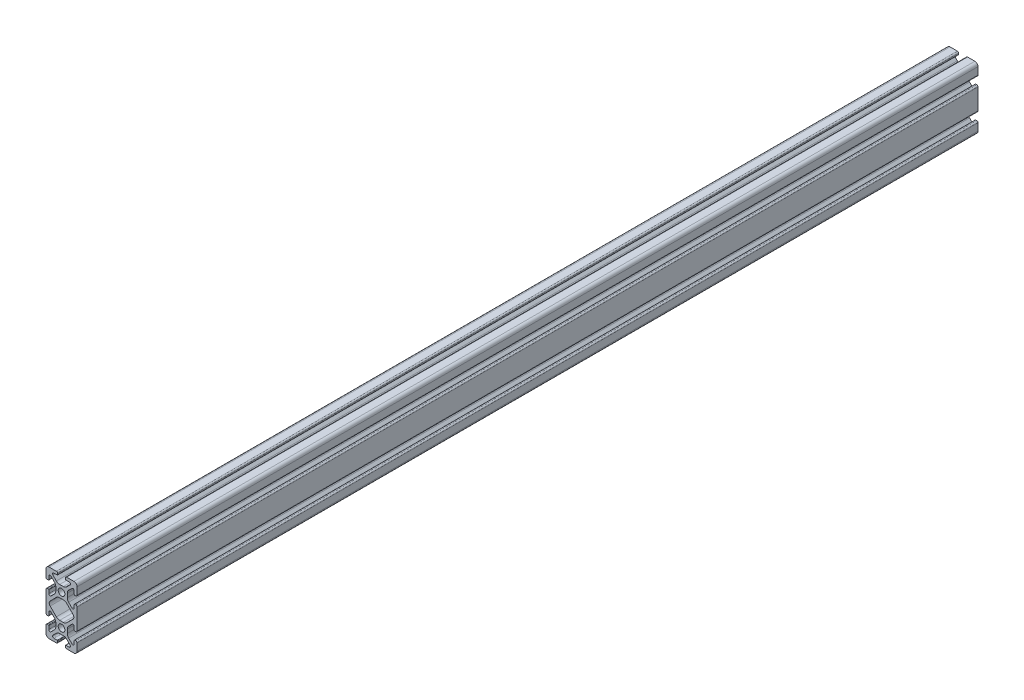
from build123d import *

# Parameters (mm, degrees)
SKETCH3_R           = 2.15
BOSS_EXTRUDE1_DEPTH = 304.8
CIRPATTERN1_COUNT   = 2
SKETCH4_R           = 2.15
CUT_EXTRUDE1_DEPTH  = 29.07


with BuildPart() as part:
    # Sketch3 → Boss-Extrude1 (new, symmetric)
    with BuildSketch(Plane.XY):
        with BuildLine():
            Line((-8.5, 7.5), (-9.2, 7.5))
            ThreePointArc((-9.2, 7.5), (-9.765685425, 7.265685425), (-10, 6.7))
            Line((-10, 6.7), (-10, 0))
            Line((-10, 0), (-7.916458339, 0))
            ThreePointArc((-7.916458339, 0), (-7.764217404, 0.765366865), (-7.330671901, 1.414213562))
            Line((-7.330671901, 1.414213562), (-3.32356512, 5.421320344))
            ThreePointArc((-3.32356512, 5.421320344), (-2.350295073, 6.071638598), (-1.202244776, 6.3))
            Line((-1.202244776, 6.3), (1.202244776, 6.3))
            ThreePointArc((1.202244776, 6.3), (2.350295073, 6.071638598), (3.32356512, 5.421320344))
            Line((3.32356512, 5.421320344), (7.330671901, 1.414213562))
            ThreePointArc((7.330671901, 1.414213562), (7.764217404, 0.765366865), (7.916458339, 0))
            Line((7.916458339, 0), (10, 0))
            Line((10, 0), (10, 6.7))
            ThreePointArc((10, 6.7), (9.765685425, 7.265685425), (9.2, 7.5))
            Line((9.2, 7.5), (8.5, 7.5))
            ThreePointArc((8.5, 7.5), (8.287867966, 7.412132034), (8.2, 7.2))
            Line((8.2, 7.2), (8.2, 5.094911614))
            ThreePointArc((8.2, 5.094911614), (7.678422063, 4.314315067), (6.757645654, 4.497468882))
            Line((6.757645654, 4.497468882), (4.578679656, 6.67643488))
            ThreePointArc((4.578679656, 6.67643488), (3.928361402, 7.649704927), (3.7, 8.797755224))
            Line((3.7, 8.797755224), (3.7, 11.202244776))
            ThreePointArc((3.7, 11.202244776), (3.928361402, 12.350295073), (4.578679656, 13.32356512))
            Line((4.578679656, 13.32356512), (6.757645654, 15.502531118))
            ThreePointArc((6.757645654, 15.502531118), (7.678422063, 15.685684933), (8.2, 14.905088386))
            Line((8.2, 14.905088386), (8.2, 12.8))
            ThreePointArc((8.2, 12.8), (8.287867966, 12.587867966), (8.5, 12.5))
            Line((8.5, 12.5), (9.2, 12.5))
            ThreePointArc((9.2, 12.5), (9.765685425, 12.734314575), (10, 13.3))
            Line((10, 13.3), (10, 18))
            ThreePointArc((10, 18), (9.414213562, 19.414213562), (8, 20))
            Line((8, 20), (3.3, 20))
            ThreePointArc((3.3, 20), (2.734314575, 19.765685425), (2.5, 19.2))
            Line((2.5, 19.2), (2.5, 18.5))
            ThreePointArc((2.5, 18.5), (2.587867966, 18.287867966), (2.8, 18.2))
            Line((2.8, 18.2), (4.905088386, 18.2))
            ThreePointArc((4.905088386, 18.2), (5.685684933, 17.678422063), (5.502531118, 16.757645654))
            Line((5.502531118, 16.757645654), (3.32356512, 14.578679656))
            ThreePointArc((3.32356512, 14.578679656), (2.350295073, 13.928361402), (1.202244776, 13.7))
            Line((1.202244776, 13.7), (-1.202244776, 13.7))
            ThreePointArc((-1.202244776, 13.7), (-2.350295073, 13.928361402), (-3.32356512, 14.578679656))
            Line((-3.32356512, 14.578679656), (-5.502531118, 16.757645654))
            ThreePointArc((-5.502531118, 16.757645654), (-5.685684933, 17.678422063), (-4.905088386, 18.2))
            Line((-4.905088386, 18.2), (-2.8, 18.2))
            ThreePointArc((-2.8, 18.2), (-2.587867966, 18.287867966), (-2.5, 18.5))
            Line((-2.5, 18.5), (-2.5, 19.2))
            ThreePointArc((-2.5, 19.2), (-2.734314575, 19.765685425), (-3.3, 20))
            Line((-3.3, 20), (-8, 20))
            ThreePointArc((-8, 20), (-9.414213562, 19.414213562), (-10, 18))
            Line((-10, 18), (-10, 13.3))
            ThreePointArc((-10, 13.3), (-9.765685425, 12.734314575), (-9.2, 12.5))
            Line((-9.2, 12.5), (-8.5, 12.5))
            ThreePointArc((-8.5, 12.5), (-8.287867966, 12.587867966), (-8.2, 12.8))
            Line((-8.2, 12.8), (-8.2, 14.905088386))
            ThreePointArc((-8.2, 14.905088386), (-7.678422063, 15.685684933), (-6.757645654, 15.502531118))
            Line((-6.757645654, 15.502531118), (-4.578679656, 13.32356512))
            ThreePointArc((-4.578679656, 13.32356512), (-3.928361402, 12.350295073), (-3.7, 11.202244776))
            Line((-3.7, 11.202244776), (-3.7, 8.797755224))
            ThreePointArc((-3.7, 8.797755224), (-3.928361402, 7.649704927), (-4.578679656, 6.67643488))
            Line((-4.578679656, 6.67643488), (-6.757645654, 4.497468882))
            ThreePointArc((-6.757645654, 4.497468882), (-7.678422063, 4.314315067), (-8.2, 5.094911614))
            Line((-8.2, 5.094911614), (-8.2, 7.2))
            ThreePointArc((-8.2, 7.2), (-8.287867966, 7.412132034), (-8.5, 7.5))
        make_face()
        with Locations(Location((0, 10, 0), (0, 0, 180))):
            Circle(SKETCH3_R, mode=Mode.SUBTRACT)
    boss_extrude1 = extrude(amount=BOSS_EXTRUDE1_DEPTH, both=True)

    # CirPattern1: Boss-Extrude1 ×2 about axis
    cirpattern1_axis = Axis((0, 0, 0), (0, 0, 1))
    for i in range(1, CIRPATTERN1_COUNT):
        add(boss_extrude1.rotate(cirpattern1_axis, i * 360 / CIRPATTERN1_COUNT))

    # Sketch4 → Cut-Extrude1 (cut)
    with BuildSketch(Plane.XY.offset(304.8)):
        with BuildLine():
            Line((-2.5, 18.5), (-2.5, 19.2))
            ThreePointArc((-2.5, 19.2), (-2.734314575, 19.765685425), (-3.3, 20))
            Line((-3.3, 20), (-8, 20))
            ThreePointArc((-8, 20), (-9.414213562, 19.414213562), (-10, 18))
            Line((-10, 18), (-10, 13.3))
            ThreePointArc((-10, 13.3), (-9.765685425, 12.734314575), (-9.2, 12.5))
            Line((-9.2, 12.5), (-8.5, 12.5))
            ThreePointArc((-8.5, 12.5), (-8.287867966, 12.587867966), (-8.2, 12.8))
            Line((-8.2, 12.8), (-8.2, 14.905088386))
            ThreePointArc((-8.2, 14.905088386), (-7.678422063, 15.685684933), (-6.757645654, 15.502531118))
            Line((-6.757645654, 15.502531118), (-4.578679656, 13.32356512))
            ThreePointArc((-4.578679656, 13.32356512), (-3.928361402, 12.350295073), (-3.7, 11.202244776))
            Line((-3.7, 11.202244776), (-3.7, 8.797755224))
            ThreePointArc((-3.7, 8.797755224), (-3.928361402, 7.649704927), (-4.578679656, 6.67643488))
            Line((-4.578679656, 6.67643488), (-6.757645654, 4.497468882))
            ThreePointArc((-6.757645654, 4.497468882), (-7.678422063, 4.314315067), (-8.2, 5.094911614))
            Line((-8.2, 5.094911614), (-8.2, 7.2))
            ThreePointArc((-8.2, 7.2), (-8.287867966, 7.412132034), (-8.5, 7.5))
            Line((-8.5, 7.5), (-9.2, 7.5))
            ThreePointArc((-9.2, 7.5), (-9.765685425, 7.265685425), (-10, 6.7))
            Line((-10, 6.7), (-10, -6.7))
            ThreePointArc((-10, -6.7), (-9.765685425, -7.265685425), (-9.2, -7.5))
            Line((-9.2, -7.5), (-8.5, -7.5))
            ThreePointArc((-8.5, -7.5), (-8.287867966, -7.412132034), (-8.2, -7.2))
            Line((-8.2, -7.2), (-8.2, -5.094911614))
            ThreePointArc((-8.2, -5.094911614), (-7.678422063, -4.314315067), (-6.757645654, -4.497468882))
            Line((-6.757645654, -4.497468882), (-4.578679656, -6.67643488))
            ThreePointArc((-4.578679656, -6.67643488), (-3.928361402, -7.649704927), (-3.7, -8.797755224))
            Line((-3.7, -8.797755224), (-3.7, -11.202244776))
            ThreePointArc((-3.7, -11.202244776), (-3.928361402, -12.350295073), (-4.578679656, -13.32356512))
            Line((-4.578679656, -13.32356512), (-6.757645654, -15.502531118))
            ThreePointArc((-6.757645654, -15.502531118), (-7.678422063, -15.685684933), (-8.2, -14.905088386))
            Line((-8.2, -14.905088386), (-8.2, -12.8))
            ThreePointArc((-8.2, -12.8), (-8.287867966, -12.587867966), (-8.5, -12.5))
            Line((-8.5, -12.5), (-9.2, -12.5))
            ThreePointArc((-9.2, -12.5), (-9.765685425, -12.734314575), (-10, -13.3))
            Line((-10, -13.3), (-10, -18))
            ThreePointArc((-10, -18), (-9.414213562, -19.414213562), (-8, -20))
            Line((-8, -20), (-3.3, -20))
            ThreePointArc((-3.3, -20), (-2.734314575, -19.765685425), (-2.5, -19.2))
            Line((-2.5, -19.2), (-2.5, -18.5))
            ThreePointArc((-2.5, -18.5), (-2.587867966, -18.287867966), (-2.8, -18.2))
            Line((-2.8, -18.2), (-4.905088386, -18.2))
            ThreePointArc((-4.905088386, -18.2), (-5.685684933, -17.678422063), (-5.502531118, -16.757645654))
            Line((-5.502531118, -16.757645654), (-3.32356512, -14.578679656))
            ThreePointArc((-3.32356512, -14.578679656), (-2.350295073, -13.928361402), (-1.202244776, -13.7))
            Line((-1.202244776, -13.7), (1.202244776, -13.7))
            ThreePointArc((1.202244776, -13.7), (2.350295073, -13.928361402), (3.32356512, -14.578679656))
            Line((3.32356512, -14.578679656), (5.502531118, -16.757645654))
            ThreePointArc((5.502531118, -16.757645654), (5.685684933, -17.678422063), (4.905088386, -18.2))
            Line((4.905088386, -18.2), (2.8, -18.2))
            ThreePointArc((2.8, -18.2), (2.587867966, -18.287867966), (2.5, -18.5))
            Line((2.5, -18.5), (2.5, -19.2))
            ThreePointArc((2.5, -19.2), (2.734314575, -19.765685425), (3.3, -20))
            Line((3.3, -20), (8, -20))
            ThreePointArc((8, -20), (9.414213562, -19.414213562), (10, -18))
            Line((10, -18), (10, -13.3))
            ThreePointArc((10, -13.3), (9.765685425, -12.734314575), (9.2, -12.5))
            Line((9.2, -12.5), (8.5, -12.5))
            ThreePointArc((8.5, -12.5), (8.287867966, -12.587867966), (8.2, -12.8))
            Line((8.2, -12.8), (8.2, -14.905088386))
            ThreePointArc((8.2, -14.905088386), (7.678422063, -15.685684933), (6.757645654, -15.502531118))
            Line((6.757645654, -15.502531118), (4.578679656, -13.32356512))
            ThreePointArc((4.578679656, -13.32356512), (3.928361402, -12.350295073), (3.7, -11.202244776))
            Line((3.7, -11.202244776), (3.7, -8.797755224))
            ThreePointArc((3.7, -8.797755224), (3.928361402, -7.649704927), (4.578679656, -6.67643488))
            Line((4.578679656, -6.67643488), (6.757645654, -4.497468882))
            ThreePointArc((6.757645654, -4.497468882), (7.678422063, -4.314315067), (8.2, -5.094911614))
            Line((8.2, -5.094911614), (8.2, -7.2))
            ThreePointArc((8.2, -7.2), (8.287867966, -7.412132034), (8.5, -7.5))
            Line((8.5, -7.5), (9.2, -7.5))
            ThreePointArc((9.2, -7.5), (9.765685425, -7.265685425), (10, -6.7))
            Line((10, -6.7), (10, 6.7))
            ThreePointArc((10, 6.7), (9.765685425, 7.265685425), (9.2, 7.5))
            Line((9.2, 7.5), (8.5, 7.5))
            ThreePointArc((8.5, 7.5), (8.287867966, 7.412132034), (8.2, 7.2))
            Line((8.2, 7.2), (8.2, 5.094911614))
            ThreePointArc((8.2, 5.094911614), (7.678422063, 4.314315067), (6.757645654, 4.497468882))
            Line((6.757645654, 4.497468882), (4.578679656, 6.67643488))
            ThreePointArc((4.578679656, 6.67643488), (3.928361402, 7.649704927), (3.7, 8.797755224))
            Line((3.7, 8.797755224), (3.7, 11.202244776))
            ThreePointArc((3.7, 11.202244776), (3.928361402, 12.350295073), (4.578679656, 13.32356512))
            Line((4.578679656, 13.32356512), (6.757645654, 15.502531118))
            ThreePointArc((6.757645654, 15.502531118), (7.678422063, 15.685684933), (8.2, 14.905088386))
            Line((8.2, 14.905088386), (8.2, 12.8))
            ThreePointArc((8.2, 12.8), (8.287867966, 12.587867966), (8.5, 12.5))
            Line((8.5, 12.5), (9.2, 12.5))
            ThreePointArc((9.2, 12.5), (9.765685425, 12.734314575), (10, 13.3))
            Line((10, 13.3), (10, 18))
            ThreePointArc((10, 18), (9.414213562, 19.414213562), (8, 20))
            Line((8, 20), (3.3, 20))
            ThreePointArc((3.3, 20), (2.734314575, 19.765685425), (2.5, 19.2))
            Line((2.5, 19.2), (2.5, 18.5))
            ThreePointArc((2.5, 18.5), (2.587867966, 18.287867966), (2.8, 18.2))
            Line((2.8, 18.2), (4.905088386, 18.2))
            ThreePointArc((4.905088386, 18.2), (5.685684933, 17.678422063), (5.502531118, 16.757645654))
            Line((5.502531118, 16.757645654), (3.32356512, 14.578679656))
            ThreePointArc((3.32356512, 14.578679656), (2.350295073, 13.928361402), (1.202244776, 13.7))
            Line((1.202244776, 13.7), (-1.202244776, 13.7))
            ThreePointArc((-1.202244776, 13.7), (-2.350295073, 13.928361402), (-3.32356512, 14.578679656))
            Line((-3.32356512, 14.578679656), (-5.502531118, 16.757645654))
            ThreePointArc((-5.502531118, 16.757645654), (-5.685684933, 17.678422063), (-4.905088386, 18.2))
            Line((-4.905088386, 18.2), (-2.8, 18.2))
            ThreePointArc((-2.8, 18.2), (-2.587867966, 18.287867966), (-2.5, 18.5))
        make_face()
        with Locations(Location((0, 10, 0), (0, 0, 180))):
            Circle(SKETCH4_R, mode=Mode.SUBTRACT)
        with Locations(Location((0, -10, 0), (0, 0, 90))):
            Circle(SKETCH4_R, mode=Mode.SUBTRACT)
        with BuildLine():
            Line((7.330671901, -1.414213562), (3.32356512, -5.421320344))
            ThreePointArc((3.32356512, -5.421320344), (2.350295073, -6.071638598), (1.202244776, -6.3))
            Line((1.202244776, -6.3), (-1.202244776, -6.3))
            ThreePointArc((-1.202244776, -6.3), (-2.350295073, -6.071638598), (-3.32356512, -5.421320344))
            Line((-3.32356512, -5.421320344), (-7.330671901, -1.414213562))
            ThreePointArc((-7.330671901, -1.414213562), (-7.916458339, 0), (-7.330671901, 1.414213562))
            Line((-7.330671901, 1.414213562), (-3.32356512, 5.421320344))
            ThreePointArc((-3.32356512, 5.421320344), (-2.350295073, 6.071638598), (-1.202244776, 6.3))
            Line((-1.202244776, 6.3), (1.202244776, 6.3))
            ThreePointArc((1.202244776, 6.3), (2.350295073, 6.071638598), (3.32356512, 5.421320344))
            Line((3.32356512, 5.421320344), (7.330671901, 1.414213562))
            ThreePointArc((7.330671901, 1.414213562), (7.916458339, 0), (7.330671901, -1.414213562))
        make_face(mode=Mode.SUBTRACT)
    extrude(amount=-CUT_EXTRUDE1_DEPTH, mode=Mode.SUBTRACT)


solid = part.part
